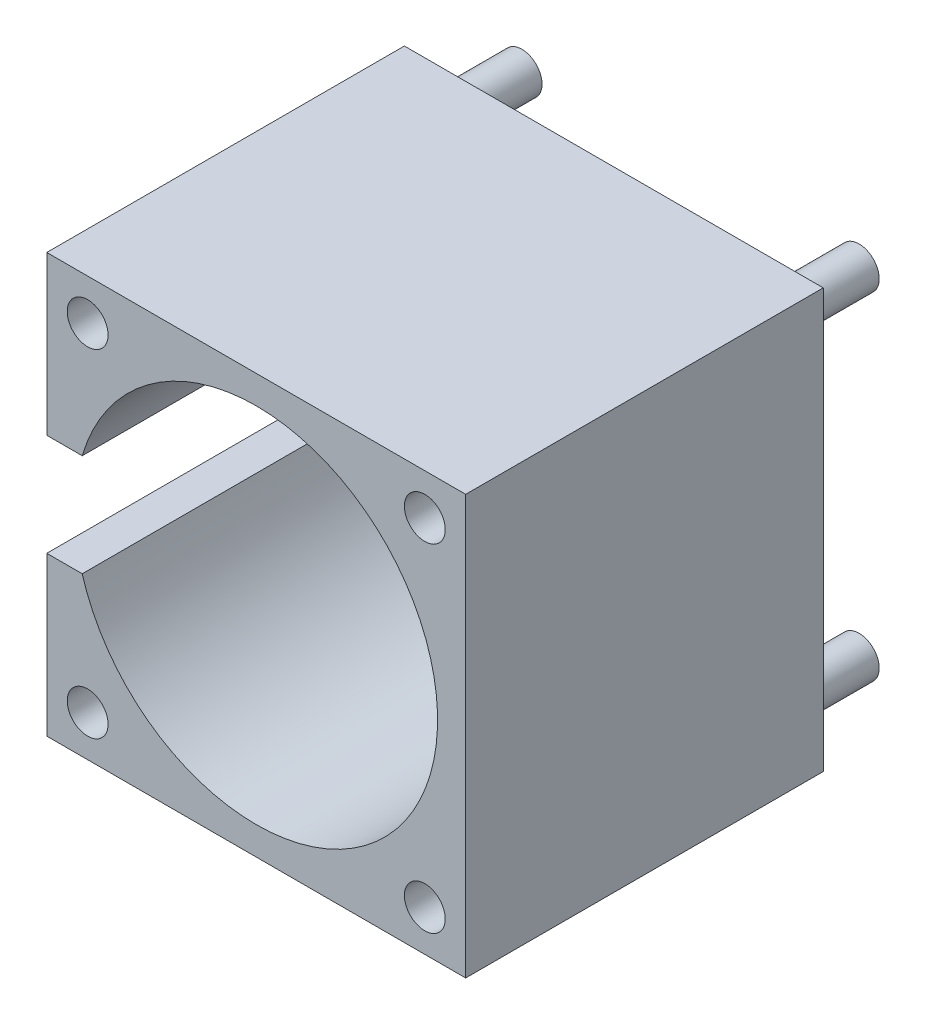
from build123d import *

# Parameters (mm, degrees)
SKETCH_1_W          = 82
SKETCH_1_H          = 82
SKETCH_1_R          = 35.5
EXTRUDE_1_DEPTH     = 70
SKETCH_4_R          = 4
CUT_EXTRUDE_2_DEPTH = 20
FILLET_2_R          = 3
FILLET_3_R          = 3
FILLET_4_R          = 3
FILLET_5_R          = 3
CUT_EXTRUDE_3_REACH = 92.896
SKETCH_3_W          = 8
SKETCH_3_H          = 20
SKETCH_5_R          = 3.95
EXTRUDE_2_DEPTH     = 15


with BuildPart() as part:
    # 草圖1 → 填料-伸長1 (new body)
    with BuildSketch(Plane.XY):
        Rectangle(SKETCH_1_W, SKETCH_1_H)
        Circle(SKETCH_1_R, mode=Mode.SUBTRACT)
    extrude(amount=EXTRUDE_1_DEPTH)

    # 草圖4 → 除料-伸長2 (cut)
    with BuildSketch(Plane.XY.offset(70)):
        with Locations((-33, 33)):
            Circle(SKETCH_4_R)
        with Locations((33, 33)):
            Circle(SKETCH_4_R)
        with Locations((33, -33)):
            Circle(SKETCH_4_R)
        with Locations((-33, -33)):
            Circle(SKETCH_4_R)
    extrude(amount=-CUT_EXTRUDE_2_DEPTH, mode=Mode.SUBTRACT)

    # 圓角2
    fillet_2_edges = [part.edges().sort_by_distance(p)[0] for p in [
        (-37, 33, 50),
    ]]
    fillet(fillet_2_edges, radius=FILLET_2_R)

    # 圓角3
    fillet_3_edges = [part.edges().sort_by_distance(p)[0] for p in [
        (29, 33, 50),
    ]]
    fillet(fillet_3_edges, radius=FILLET_3_R)

    # 圓角4
    fillet_4_edges = [part.edges().sort_by_distance(p)[0] for p in [
        (-37, -33, 50),
    ]]
    fillet(fillet_4_edges, radius=FILLET_4_R)

    # 圓角5
    fillet_5_edges = [part.edges().sort_by_distance(p)[0] for p in [
        (29, -33, 50),
    ]]
    fillet(fillet_5_edges, radius=FILLET_5_R)

    # 草圖3 → 除料-伸長3 (cut, up to next)
    with BuildSketch(Plane.XY.offset(70), mode=Mode.PRIVATE) as cut_extrude_3_sk1:
        with Locations((-37, 0)):
            Rectangle(SKETCH_3_W, SKETCH_3_H)
    cut_extrude_3_tool1 = extrude(cut_extrude_3_sk1.sketch, amount=-CUT_EXTRUDE_3_REACH, mode=Mode.PRIVATE) & part.part
    add(cut_extrude_3_tool1.solids().sort_by_distance((-37, 0, 70))[0], mode=Mode.SUBTRACT)

    # 草圖5 → 填料-伸長2 (add)
    with BuildSketch(Plane(origin=(0, 0, 0), x_dir=(-1, 0, 0), z_dir=(0, 0, -1))):
        with Locations((33, 33)):
            Circle(SKETCH_5_R)
        with Locations((-33, 33)):
            Circle(SKETCH_5_R)
        with Locations((33, -33)):
            Circle(SKETCH_5_R)
        with Locations((-33, -33)):
            Circle(SKETCH_5_R)
    extrude(amount=EXTRUDE_2_DEPTH)


solid = part.part
